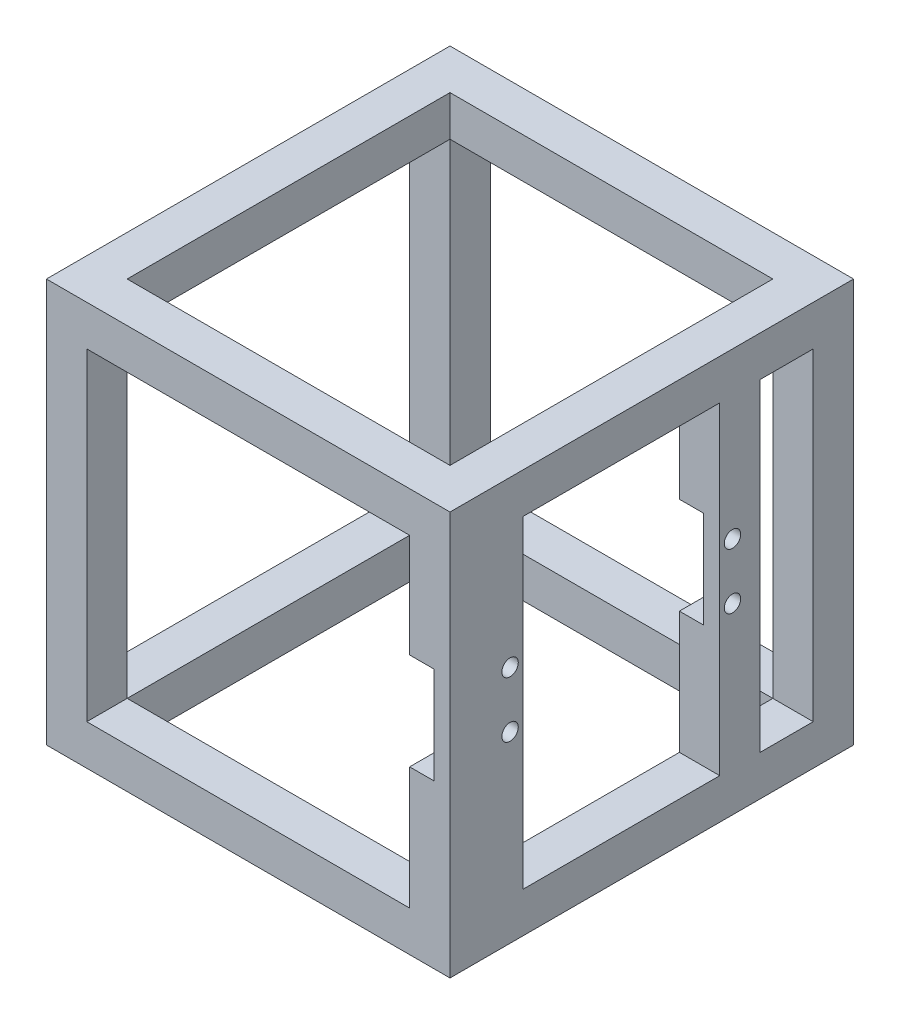
from build123d import *

# Parameters (mm, degrees)
SKETCH1_W          = 50
SKETCH1_H          = 50
SKETCH1_W_2        = 40
SKETCH1_H_2        = 40
EXTRUDE1_DEPTH     = 50
SKETCH2_W          = 40
SKETCH2_H          = 40
CUT_EXTRUDE1_DEPTH = 50
SKETCH3_W          = 40
SKETCH3_H          = 40
CUT_EXTRUDE2_DEPTH = 10
SKETCH4_W          = 24.4
SKETCH4_H          = 40
SKETCH4_W_2        = 6.57952911
CUT_EXTRUDE3_DEPTH = 10
SKETCH5_R          = 1.016
CUT_EXTRUDE4_DEPTH = 10
SKETCH6_W          = 3
SKETCH6_H          = 12
CUT_EXTRUDE5_DEPTH = 40


with BuildPart() as part:
    # Sketch1 → Extrude1 (new body)
    with BuildSketch(Plane.XY):
        with Locations((-25, 25)):
            Rectangle(SKETCH1_W, SKETCH1_H)
        with Locations((-25, 25)):
            Rectangle(SKETCH1_W_2, SKETCH1_H_2, mode=Mode.SUBTRACT)
    extrude(amount=EXTRUDE1_DEPTH)

    # Sketch2 → Cut-Extrude1 (cut)
    with BuildSketch(Plane.XZ):
        with Locations((-25, 25)):
            Rectangle(SKETCH2_W, SKETCH2_H)
    extrude(amount=-CUT_EXTRUDE1_DEPTH, mode=Mode.SUBTRACT)

    # Sketch3 → Cut-Extrude2 (cut)
    with BuildSketch(Plane.ZY.offset(50)):
        with Locations((25, 25)):
            Rectangle(SKETCH3_W, SKETCH3_H)
    extrude(amount=-CUT_EXTRUDE2_DEPTH, mode=Mode.SUBTRACT)

    # Sketch4 → Cut-Extrude3 (cut)
    with BuildSketch(Plane(origin=(0, 0, 0), x_dir=(0, 0, -1), z_dir=(1, 0, 0))):
        with Locations((-28.77952911, 25)):
            Rectangle(SKETCH4_W, SKETCH4_H)
        with Locations((-8.289764555, 25)):
            Rectangle(SKETCH4_W_2, SKETCH4_H)
    extrude(amount=-CUT_EXTRUDE3_DEPTH, mode=Mode.SUBTRACT)

    # Sketch5 → Cut-Extrude4 (cut)
    with BuildSketch(Plane(origin=(0, 0, 0), x_dir=(0, 0, -1), z_dir=(1, 0, 0))):
        with Locations((-42.55752911, 29.616065633)):
            Circle(SKETCH5_R)
        with Locations((-42.55752911, 22.692268102)):
            Circle(SKETCH5_R)
        with Locations((-15.00152911, 22.692268102)):
            Circle(SKETCH5_R)
        with Locations((-15.00152911, 29.616065633)):
            Circle(SKETCH5_R)
    extrude(amount=-CUT_EXTRUDE4_DEPTH, mode=Mode.SUBTRACT)

    # Sketch6 → Cut-Extrude5 (cut)
    with BuildSketch(Plane.XY.offset(50)):
        with Locations((-3.5, 26.156065633)):
            Rectangle(SKETCH6_W, SKETCH6_H)
    extrude(amount=-CUT_EXTRUDE5_DEPTH, mode=Mode.SUBTRACT)


solid = part.part
